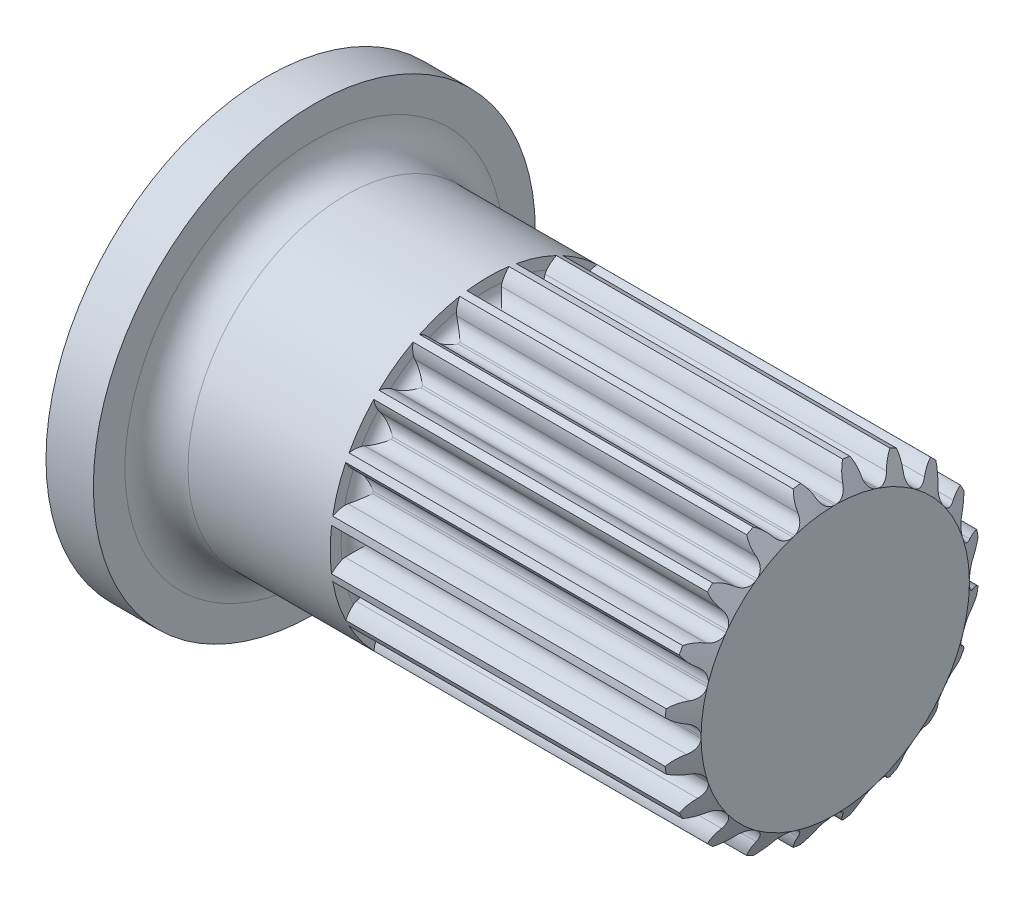
from build123d import *

# Parameters (mm, degrees)
FILLET1_R                = 2
CUT_EXTRUDE2_DEPTH       = 22
FILLET2_R                = 0.8
CIRPATTERN1_COUNT        = 20
FILLET2_OF_CIRPATTERN1_R = 0.8
SKETCH3_OUTSIDE_W        = 44.168
SKETCH3_OUTSIDE_H        = 44.168
SKETCH3_OUTSIDE_R        = 8.5
CUT_EXTRUDE3_DEPTH       = 1
CUT_EXTRUDE3_DRAFT       = -60


with BuildPart() as part:
    # Sketch1 → Revolve1 (revolve)
    with BuildSketch(Plane.XY):
        Polygon((36, 0), (0, 0), (0, 14), (3, 14), (3, 10), (36, 10), align=None)
    revolve(axis=Axis((36, 0, 0), (-1, 0, 0)))

    # Fillet1
    fillet1_edges = [part.edges().sort_by_distance(p)[0] for p in [
        (3, -10, 0),
    ]]
    fillet(fillet1_edges, radius=FILLET1_R)

    # Sketch2 → Cut-Extrude2 (cut)
    with BuildSketch(Plane(origin=(36, 0, 0), x_dir=(0, 0, -1), z_dir=(1, 0, 0))):
        with BuildLine():
            ThreePointArc((-0.75, 8.466847111), (-0.894801138, 9.247834683), (-1.332174328, 9.910868356))
            ThreePointArc((-1.332174328, 9.910868356), (0, 10), (1.332174328, 9.910868356))
            ThreePointArc((1.332174328, 9.910868356), (0.894801138, 9.247834683), (0.75, 8.466847111))
            ThreePointArc((0.75, 8.466847111), (0, 8.5), (-0.75, 8.466847111))
        make_face()
    cut_extrude2 = extrude(amount=-CUT_EXTRUDE2_DEPTH, mode=Mode.SUBTRACT)

    # Fillet2
    fillet2_edges = [part.edges().sort_by_distance(p)[0] for p in [
        (14, 8.5, 0),
        (25, 8.466847111, -0.75),
        (25, 8.466847111, 0.75),
    ]]
    fillet(fillet2_edges, radius=FILLET2_R)

    # CirPattern1: Cut-Extrude2 ×20 about axis
    cirpattern1_axis = Axis((0, 0, 0), (1, 0, 0))
    for i in range(1, CIRPATTERN1_COUNT):
        add(cut_extrude2.rotate(cirpattern1_axis, i * 360 / CIRPATTERN1_COUNT), mode=Mode.SUBTRACT)

    # Fillet2 of CirPattern1
    fillet2_of_cirpattern1_edges = [part.edges().sort_by_distance(p)[0] for p in [
        (14, 8.083980389, 2.626644452),
        (25, 8.284212863, 1.903107259),
        (25, 7.820687372, 3.329692033),
        (14, 6.876644452, 4.996174644),
        (25, 7.290662141, 4.369925119),
        (25, 6.408984262, 5.583450611),
        (14, 4.996174644, 6.876644452),
        (25, 5.583450611, 6.408984262),
        (25, 4.369925119, 7.290662141),
        (14, 2.626644452, 8.083980389),
        (25, 3.329692033, 7.820687372),
        (25, 1.903107259, 8.284212863),
        (14, 0, 8.5),
        (25, 0.75, 8.466847111),
        (25, -0.75, 8.466847111),
        (14, -2.626644452, 8.083980389),
        (25, -1.903107259, 8.284212863),
        (25, -3.329692033, 7.820687372),
        (14, -4.996174644, 6.876644452),
        (25, -4.369925119, 7.290662141),
        (25, -5.583450611, 6.408984262),
        (14, -6.876644452, 4.996174644),
        (25, -6.408984262, 5.583450611),
        (25, -7.290662141, 4.369925119),
        (14, -8.083980389, 2.626644452),
        (25, -7.820687372, 3.329692033),
        (25, -8.284212863, 1.903107259),
        (14, -8.5, 0),
        (25, -8.466847111, 0.75),
        (25, -8.466847111, -0.75),
        (14, -8.083980389, -2.626644452),
        (25, -8.284212863, -1.903107259),
        (25, -7.820687372, -3.329692033),
        (14, -6.876644452, -4.996174644),
        (25, -7.290662141, -4.369925119),
        (25, -6.408984262, -5.583450611),
        (14, -4.996174644, -6.876644452),
        (25, -5.583450611, -6.408984262),
        (25, -4.369925119, -7.290662141),
        (14, -2.626644452, -8.083980389),
        (25, -3.329692033, -7.820687372),
        (25, -1.903107259, -8.284212863),
        (14, 0, -8.5),
        (25, -0.75, -8.466847111),
        (25, 0.75, -8.466847111),
        (14, 2.626644452, -8.083980389),
        (25, 1.903107259, -8.284212863),
        (25, 3.329692033, -7.820687372),
        (14, 4.996174644, -6.876644452),
        (25, 4.369925119, -7.290662141),
        (25, 5.583450611, -6.408984262),
        (14, 6.876644452, -4.996174644),
        (25, 6.408984262, -5.583450611),
        (25, 7.290662141, -4.369925119),
        (14, 8.083980389, -2.626644452),
        (25, 7.820687372, -3.329692033),
        (25, 8.284212863, -1.903107259),
    ]]
    fillet(fillet2_of_cirpattern1_edges, radius=FILLET2_OF_CIRPATTERN1_R)


with BuildPart() as cut_extrude3_tool:
    # Sketch3 outside → Cut-Extrude3 (with draft: the straight prism first)
    with BuildSketch(Plane(origin=(36, 0, 0), x_dir=(0, 0, -1), z_dir=(1, 0, 0))):
        Rectangle(SKETCH3_OUTSIDE_W, SKETCH3_OUTSIDE_H)
        Circle(SKETCH3_OUTSIDE_R, mode=Mode.SUBTRACT)
    extrude(amount=-CUT_EXTRUDE3_DEPTH)
    # Cut-Extrude3: the draft: its side faces are tilted about the plane it starts from
    cut_extrude3_sides = [cut_extrude3_tool.faces().sort_by_distance(p)[0] for p in [
        (35.5, -22.084, 0),
        (35.5, 0, -22.084),
        (35.5, 22.084, 0),
        (35.5, 0, 22.084),
        (35.5, 0, 8.5),
    ]]
    draft(cut_extrude3_sides, Plane(origin=(36, 0, 0), x_dir=(0, 0, -1), z_dir=(1, 0, 0)), CUT_EXTRUDE3_DRAFT)


with BuildPart() as part_1:
    add(part.part)

    # Cut-Extrude3: cut by cut_extrude3_tool
    add(cut_extrude3_tool.part, mode=Mode.SUBTRACT)


solid = part_1.part
